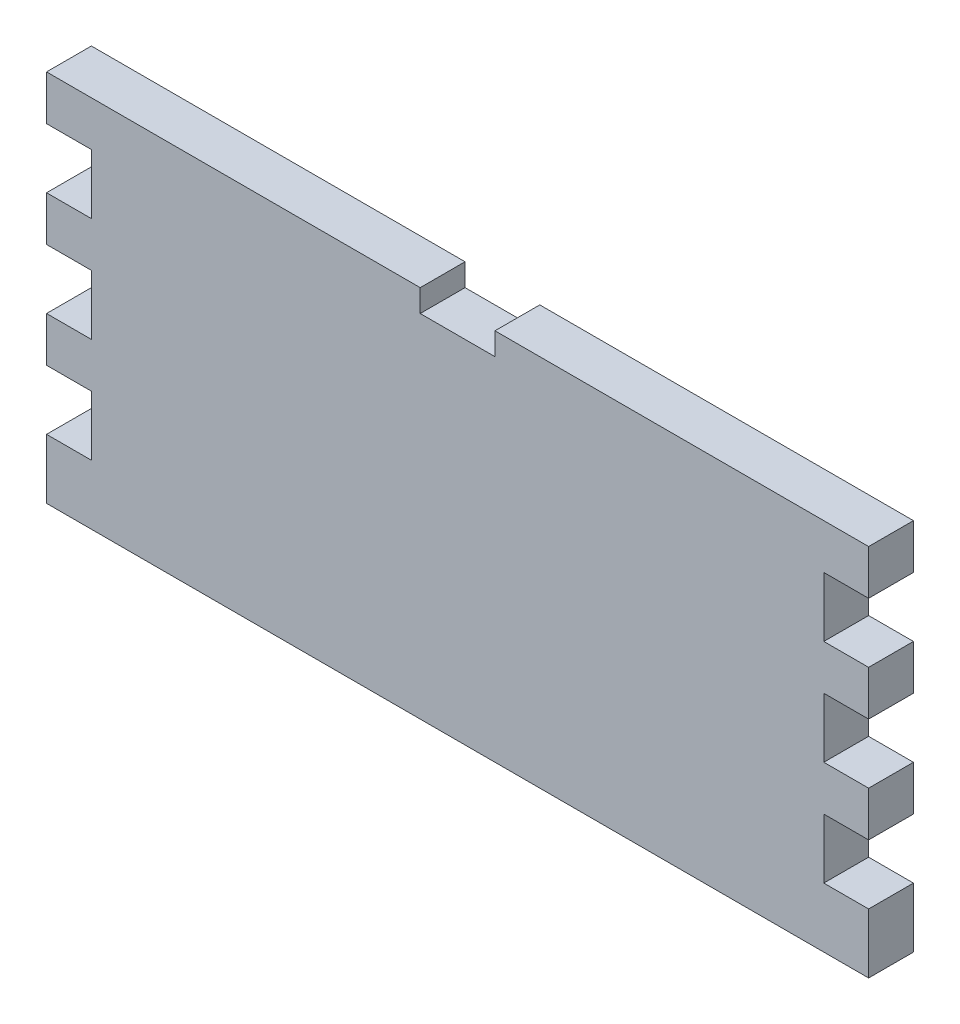
from build123d import *

# Parameters (mm, degrees)
SKETCH1_W           = 55
SKETCH1_H           = 25
BOSS_EXTRUDE1_DEPTH = 3
SKETCH2_W           = 5
SKETCH2_H           = 1.5
CUT_EXTRUDE1_DEPTH  = 3
SKETCH3_W           = 3
SKETCH3_H           = 4
CUT_EXTRUDE2_DEPTH  = 3
SKETCH4_W           = 3
SKETCH4_H           = 4
CUT_EXTRUDE3_DEPTH  = 3


with BuildPart() as part:
    # Sketch1 → Boss-Extrude1 (new body)
    with BuildSketch(Plane.XY):
        Rectangle(SKETCH1_W, SKETCH1_H)
    extrude(amount=BOSS_EXTRUDE1_DEPTH)

    # Sketch2 → Cut-Extrude1 (cut)
    with BuildSketch(Plane.XY.offset(3)):
        with Locations((0, 11.75)):
            Rectangle(SKETCH2_W, SKETCH2_H)
    extrude(amount=-CUT_EXTRUDE1_DEPTH, mode=Mode.SUBTRACT)

    # Sketch3 → Cut-Extrude2 (cut)
    with BuildSketch(Plane.XY.offset(3)):
        with Locations((-26, 7.5)):
            Rectangle(SKETCH3_W, SKETCH3_H)
        with Locations((-26, 0.5)):
            Rectangle(SKETCH3_W, SKETCH3_H)
        with Locations((-26, -6.5)):
            Rectangle(SKETCH3_W, SKETCH3_H)
    extrude(amount=-CUT_EXTRUDE2_DEPTH, mode=Mode.SUBTRACT)

    # Sketch4 → Cut-Extrude3 (cut)
    with BuildSketch(Plane.XY.offset(3)):
        with Locations((26, 7.5)):
            Rectangle(SKETCH4_W, SKETCH4_H)
        with Locations((26, 0.5)):
            Rectangle(SKETCH4_W, SKETCH4_H)
        with Locations((26, -6.5)):
            Rectangle(SKETCH4_W, SKETCH4_H)
    extrude(amount=-CUT_EXTRUDE3_DEPTH, mode=Mode.SUBTRACT)


solid = part.part
